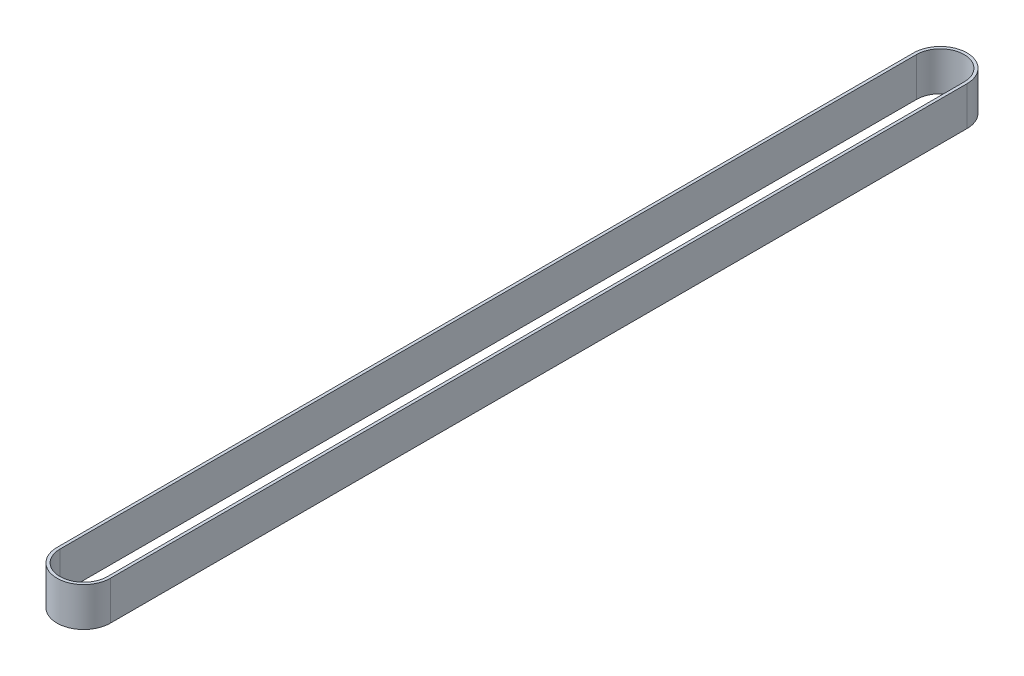
from build123d import *

# Parameters (mm, degrees)
EXTRUDE_1_DEPTH = 10


with BuildPart() as part:
    # 草图1 → 凸台-拉伸1 (new body)
    with BuildSketch(Plane(origin=(0, 0, 0), x_dir=(1, 0, 0), z_dir=(0, 1, 0))):
        with BuildLine():
            Line((-6.86, -110.05), (-6.86, 110.05))
            ThreePointArc((-6.86, 110.05), (0, 116.91), (6.86, 110.05))
            Line((6.86, 110.05), (6.86, -110.05))
            ThreePointArc((6.86, -110.05), (0, -116.91), (-6.86, -110.05))
        make_face()
        with BuildLine():
            Line((-6.11, -110.05), (-6.11, 110.05))
            ThreePointArc((-6.11, 110.05), (0, 116.16), (6.11, 110.05))
            Line((6.11, 110.05), (6.11, -110.05))
            ThreePointArc((6.11, -110.05), (0, -116.16), (-6.11, -110.05))
        make_face(mode=Mode.SUBTRACT)
    extrude(amount=EXTRUDE_1_DEPTH)


solid = part.part
